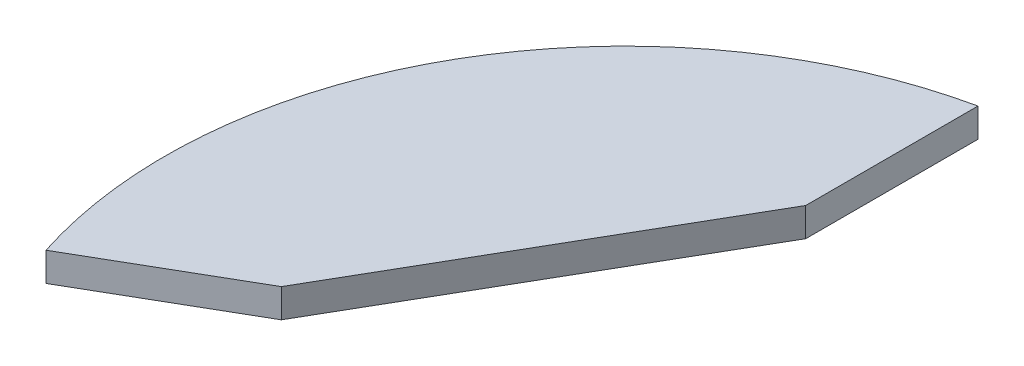
from build123d import *

# Parameters (mm, degrees)
EXTRUDE1_DEPTH = 3.175


with BuildPart() as part:
    # Sketch1 → Extrude1 (new body)
    with BuildSketch(Plane(origin=(0, 0, 0), x_dir=(1, 0, 0), z_dir=(0, 1, 0))):
        with BuildLine():
            Line((-10.7442, 49.650802273), (-10.7442, 30.650802273))
            Line((-10.7442, 30.650802273), (-31.916473415, -6.020650993))
            Line((-31.916473415, -6.020650993), (-48.370956087, -15.520650993))
            ThreePointArc((-48.370956087, -15.520650993), (-43.994090512, 25.4), (-10.7442, 49.650802273))
        make_face()
    extrude(amount=EXTRUDE1_DEPTH)


solid = part.part
